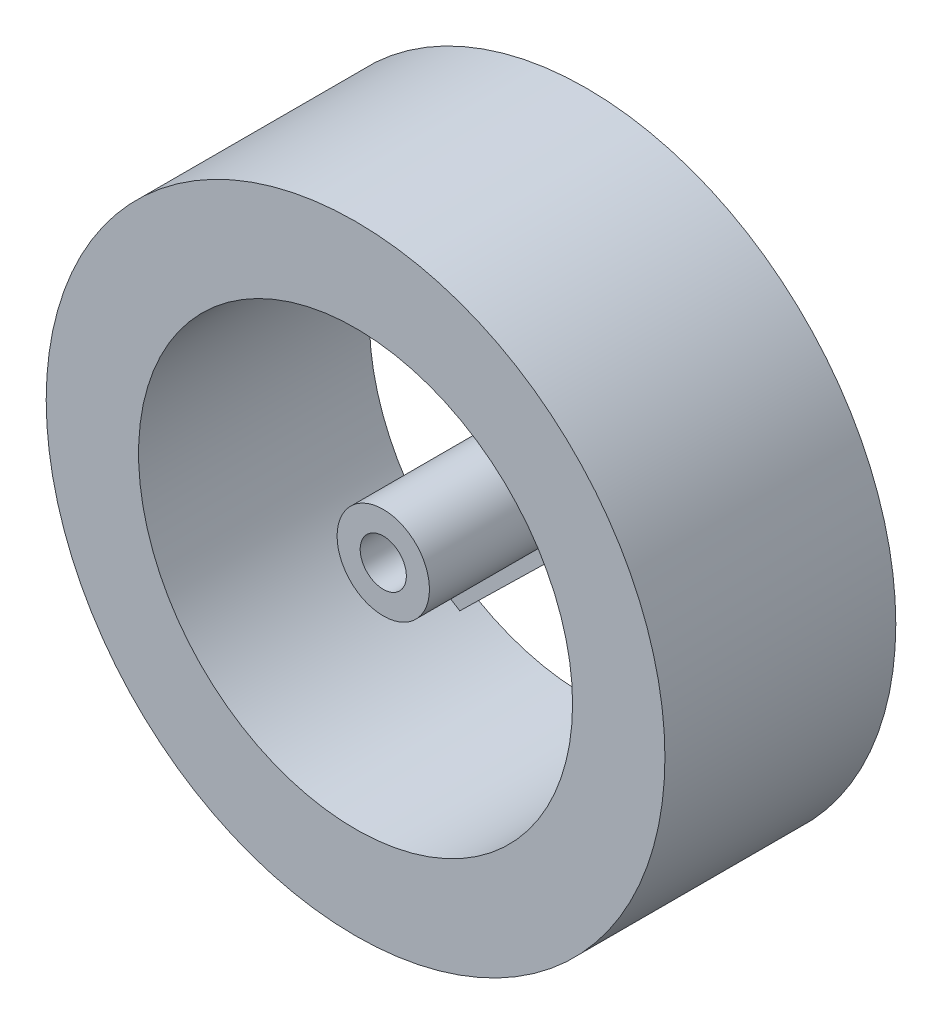
from build123d import *

# Parameters (mm, degrees)
SKETCH_1_R      = 33.5
SKETCH_1_R_2    = 23.5
EXTRUDE_1_DEPTH = 25
SKETCH_2_R      = 10
EXTRUDE_2_DEPTH = 2
SKETCH_3_R      = 5
SKETCH_3_R_2    = 2.5
EXTRUDE_3_DEPTH = 20


with BuildPart() as part:
    # 草圖1 → 填料-伸長1 (new body)
    with BuildSketch(Plane.XY):
        Circle(SKETCH_1_R)
        Circle(SKETCH_1_R_2, mode=Mode.SUBTRACT)
    extrude(amount=EXTRUDE_1_DEPTH)

    # 草圖2 → 填料-伸長2 (add)
    with BuildSketch(Plane(origin=(0, 0, 0), x_dir=(-1, 0, 0), z_dir=(0, 0, -1))):
        with BuildLine():
            ThreePointArc((-5, 8.660254038), (-2.588190451, 9.659258263), (0, 10))
            Line((0, 10), (0, 23.5))
            ThreePointArc((0, 23.5), (-1.251777149, 23.46663704), (-2.5, 23.366642891))
            Line((-2.5, 23.366642891), (-5, 8.660254038))
        make_face()
        with BuildLine():
            Line((0, 23.5), (0, 10))
            ThreePointArc((0, 10), (2.588190451, 9.659258263), (5, 8.660254038))
            Line((5, 8.660254038), (2.5, 23.366642891))
            ThreePointArc((2.5, 23.366642891), (1.251777149, 23.46663704), (0, 23.5))
        make_face()
        Circle(SKETCH_2_R)
        with BuildLine():
            ThreePointArc((-9.781476007, -2.079116908), (-9.510565163, 3.090169944), (-6.691306064, 7.431448255))
            Line((-6.691306064, 7.431448255), (-21.4504555, 9.598331046))
            ThreePointArc((-21.4504555, 9.598331046), (-22.349828133, 7.261899368), (-22.995540471, 4.843048464))
            Line((-22.995540471, 4.843048464), (-9.781476007, -2.079116908))
        make_face()
        with BuildLine():
            ThreePointArc((-1.045284633, -9.945218954), (-5.877852523, -8.090169944), (-9.135454576, -4.067366431))
            Line((-9.135454576, -4.067366431), (-15.757110573, -17.43454807))
            ThreePointArc((-15.757110573, -17.43454807), (-13.812953429, -19.011899368), (-11.712025601, -20.373474331))
            Line((-11.712025601, -20.373474331), (-1.045284633, -9.945218954))
        make_face()
        with BuildLine():
            Line((15.757110573, -17.43454807), (9.135454576, -4.067366431))
            ThreePointArc((9.135454576, -4.067366431), (5.877852523, -8.090169944), (1.045284633, -9.945218954))
            Line((1.045284633, -9.945218954), (11.712025601, -20.373474331))
            ThreePointArc((11.712025601, -20.373474331), (13.812953429, -19.011899368), (15.757110573, -17.43454807))
        make_face()
        with BuildLine():
            Line((21.4504555, 9.598331046), (6.691306064, 7.431448255))
            ThreePointArc((6.691306064, 7.431448255), (9.135454576, 4.067366431), (10, 0))
            ThreePointArc((10, 0), (9.945218954, -1.045284633), (9.781476007, -2.079116908))
            Line((9.781476007, -2.079116908), (22.995540471, 4.843048464))
            ThreePointArc((22.995540471, 4.843048464), (22.349828133, 7.261899368), (21.4504555, 9.598331046))
        make_face()
    extrude(amount=-EXTRUDE_2_DEPTH)

    # 草圖3 → 填料-伸長3 (add)
    with BuildSketch(Plane.XY.offset(2)):
        with Locations(Location((0, 0, 0), (0, 0, 180))):
            Circle(SKETCH_3_R)
        Circle(SKETCH_3_R_2, mode=Mode.SUBTRACT)
    extrude(amount=EXTRUDE_3_DEPTH)


solid = part.part
